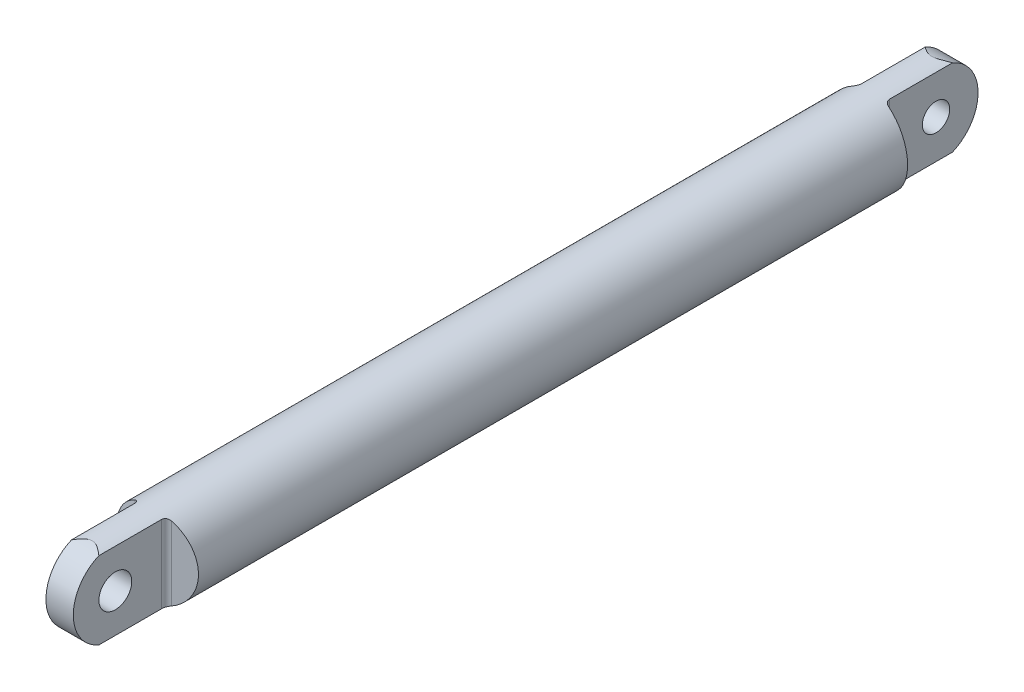
from build123d import *

# Parameters (mm, degrees)
SKETCH1_R               = 7.5
BOSS_EXTRUDE1_DEPTH     = 82.685
CUT_EXTRUDE2_DEPTH      = 84.362516907
CUT_EXTRUDE3_DEPTH      = 84.362517024
CUT_EXTRUDE4_DEPTH      = 84.624513422
CUT_EXTRUDE4_DEPTH_BACK = 84.624513422
SKETCH8_R               = 2.5
FILLET1_R               = 1
FILLET1_OF_MIRROR2_R    = 1
SKETCH9_R               = 3
CUT_EXTRUDE5_DEPTH      = 10


with BuildPart() as part:
    # Sketch1 → Boss-Extrude1 (new, symmetric)
    with BuildSketch(Plane.XY):
        Circle(SKETCH1_R)
    extrude(amount=BOSS_EXTRUDE1_DEPTH, both=True)

    # Sketch6 → Cut-Extrude2 (cut, symmetric)
    with BuildSketch(Plane(origin=(0, 0, 0), x_dir=(0, 0, -1), z_dir=(1, 0, 0))):
        with BuildLine():
            Line((82.685, 0), (82.685, 7.5))
            Line((82.685, 7.5), (76.685, 7.5))
            ThreePointArc((76.685, 7.5), (81.000428973, 4.802343178), (82.685, 0))
        make_face()
        with BuildLine():
            Line((82.685, -7.5), (82.685, 0))
            ThreePointArc((82.685, 0), (81.000428973, -4.802343178), (76.685, -7.5))
            Line((76.685, -7.5), (82.685, -7.5))
        make_face()
    cut_extrude2 = extrude(amount=CUT_EXTRUDE2_DEPTH, both=True, mode=Mode.SUBTRACT)

    # Sketch7 → Cut-Extrude3 (cut, symmetric)
    with BuildSketch(Plane(origin=(0, 0, 0), x_dir=(1, 0, 0), z_dir=(0, 1, 0))):
        Polygon((-2.5, 82.685), (-2.5, 65.685), (-7.5, 64.803365096), (-7.5, 82.685), align=None)
        Polygon((7.5, 82.685), (2.5, 82.685), (2.5, 65.685), (7.5, 64.803365096), align=None)
    cut_extrude3 = extrude(amount=CUT_EXTRUDE3_DEPTH, both=True, mode=Mode.SUBTRACT)

    # Sketch8 → Cut-Extrude4 (cut, two sides: drawn at the far end of the back side and taken through both)
    with BuildSketch(Plane(origin=(-2.5, 0, 0), x_dir=(0, 0, -1), z_dir=(1, 0, 0)).offset(-CUT_EXTRUDE4_DEPTH_BACK)):
        with Locations((74.9975, 0)):
            Circle(SKETCH8_R)
    extrude(amount=CUT_EXTRUDE4_DEPTH + CUT_EXTRUDE4_DEPTH_BACK, mode=Mode.SUBTRACT)

    # Fillet1
    fillet1_edges = [part.edges().sort_by_distance(p)[0] for p in [
        (-2.5, 0, -65.685),
        (2.5, 0, -65.685),
    ]]
    fillet(fillet1_edges, radius=FILLET1_R)

    # Mirror2: Cut-Extrude2, Cut-Extrude3 across plane
    add(cut_extrude2.mirror(Plane.XY), mode=Mode.SUBTRACT)
    add(cut_extrude3.mirror(Plane.XY), mode=Mode.SUBTRACT)

    # Fillet1 of Mirror2
    fillet1_of_mirror2_edges = [part.edges().sort_by_distance(p)[0] for p in [
        (-2.5, 0, 65.685),
        (2.5, 0, 65.685),
    ]]
    fillet(fillet1_of_mirror2_edges, radius=FILLET1_OF_MIRROR2_R)

    # Sketch9 → Cut-Extrude5 (cut)
    with BuildSketch(Plane(origin=(2.5, 0, 0), x_dir=(0, 0, -1), z_dir=(1, 0, 0))):
        with Locations((-74.9975, 0)):
            Circle(SKETCH9_R)
    extrude(amount=-CUT_EXTRUDE5_DEPTH, mode=Mode.SUBTRACT)


solid = part.part
